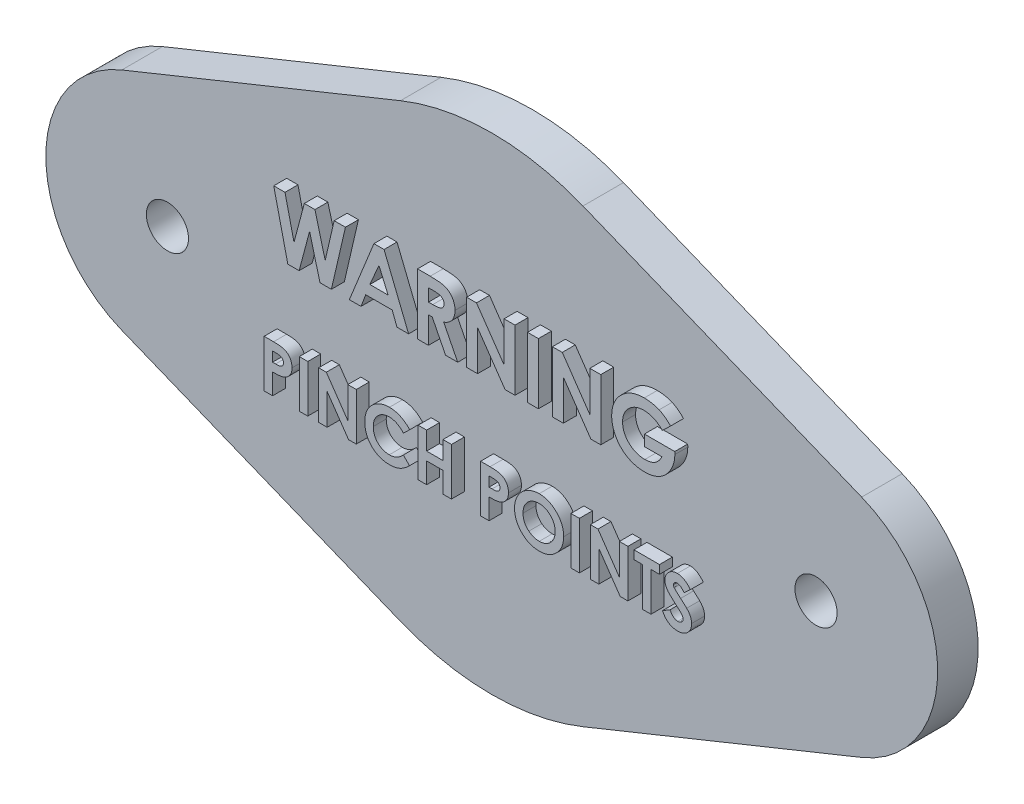
from build123d import *

# Parameters (mm, degrees)
SKETCH1_R              = 38.1
SKETCH1_R_2            = 19.05
BOSS_EXTRUDE1_DEPTH    = 6.35
SKETCH2_R              = 3.302
CUT_EXTRUDE1_DEPTH     = 80.818262321
BOSS_EXTRUDE2_DEPTH    = 2.032
BOSS_EXTRUDE2_2_DEPTH  = 2.032
BOSS_EXTRUDE2_3_DEPTH  = 2.032
BOSS_EXTRUDE2_4_DEPTH  = 2.032
SKETCH3_W              = 1.709615385
SKETCH3_H              = 9.525
BOSS_EXTRUDE2_5_DEPTH  = 2.032
BOSS_EXTRUDE2_6_DEPTH  = 2.032
BOSS_EXTRUDE2_7_DEPTH  = 2.032
BOSS_EXTRUDE2_8_DEPTH  = 2.032
SKETCH3_W_2            = 1.329700855
SKETCH3_H_2            = 7.408333333
BOSS_EXTRUDE2_9_DEPTH  = 2.032
BOSS_EXTRUDE2_10_DEPTH = 2.032
BOSS_EXTRUDE2_11_DEPTH = 2.032
BOSS_EXTRUDE2_12_DEPTH = 2.032
BOSS_EXTRUDE2_13_DEPTH = 2.032
BOSS_EXTRUDE2_14_DEPTH = 2.032
SKETCH3_W_3            = 1.329700854
BOSS_EXTRUDE2_15_DEPTH = 2.032
BOSS_EXTRUDE2_16_DEPTH = 2.032
BOSS_EXTRUDE2_17_DEPTH = 2.032
BOSS_EXTRUDE2_18_DEPTH = 2.032


with BuildPart() as part:
    # Sketch1 → Boss-Extrude1 (new body)
    with BuildSketch(Plane.XY):
        Circle(SKETCH1_R)
        with Locations((-50.8, 0)):
            Circle(SKETCH1_R_2)
        with BuildLine():
            Line((-14.2875, 35.319645295), (-57.94375, 17.659822647))
            ThreePointArc((-57.94375, 17.659822647), (-46.126174273, 18.467751706), (-36.115625, 12.135552351))
            ThreePointArc((-36.115625, 12.135552351), (-27.739760162, 26.117344929), (-14.2875, 35.319645295))
        make_face()
        with Locations((50.8, 0)):
            Circle(SKETCH1_R_2)
        with BuildLine():
            ThreePointArc((-36.115625, -12.135552351), (-46.126174273, -18.467751706), (-57.94375, -17.659822647))
            Line((-57.94375, -17.659822647), (-14.2875, -35.319645295))
            ThreePointArc((-14.2875, -35.319645295), (-27.739760162, -26.117344929), (-36.115625, -12.135552351))
        make_face()
        with BuildLine():
            ThreePointArc((36.115625, -12.135552351), (27.739760162, -26.117344929), (14.2875, -35.319645295))
            Line((14.2875, -35.319645295), (57.94375, -17.659822647))
            ThreePointArc((57.94375, -17.659822647), (46.126174273, -18.467751706), (36.115625, -12.135552351))
        make_face()
        with BuildLine():
            Line((57.94375, 17.659822647), (14.2875, 35.319645295))
            ThreePointArc((14.2875, 35.319645295), (27.739760162, 26.117344929), (36.115625, 12.135552351))
            ThreePointArc((36.115625, 12.135552351), (46.126174273, 18.467751706), (57.94375, 17.659822647))
        make_face()
    extrude(amount=BOSS_EXTRUDE1_DEPTH)

    # Sketch2 → Cut-Extrude1 (cut, through all)
    with BuildSketch(Plane.XY.offset(6.35)):
        with Locations((-50.8, 0)):
            Circle(SKETCH2_R)
        with Locations((50.8, 0)):
            Circle(SKETCH2_R)
    extrude(amount=-CUT_EXTRUDE1_DEPTH, mode=Mode.SUBTRACT)


with BuildPart() as body_2:
    # Sketch3 → Boss-Extrude2 (new body)
    with BuildSketch(Plane.XY.offset(6.35)):
        Polygon((-32.116346154, 15.875), (-30.351397236, 15.875), (-28.941346154, 9.794035457), (-27.325225361, 15.875), (-25.663311298, 15.875), (-24.056730769, 9.794035457), (-22.650495793, 15.875), (-20.881730769, 15.875), (-23.085531851, 6.35), (-24.871469351, 6.35), (-26.499038462, 12.507286659), (-28.136147837, 6.35), (-29.908728966, 6.35), align=None)
    extrude(amount=BOSS_EXTRUDE2_DEPTH)


with BuildPart() as body_3:
    # Sketch3 → Boss-Extrude2 2 (new body)
    with BuildSketch(Plane.XY.offset(6.35)):
        Polygon((-16.422611178, 15.875), (-14.837019231, 15.875), (-10.990384615, 6.35), (-12.816391226, 6.35), (-13.556715745, 8.303846154), (-17.706730769, 8.303846154), (-18.447055288, 6.35), (-20.271153846, 6.35), align=None)
        Polygon((-15.630769231, 13.320117187), (-17.057992788, 10.013461538), (-14.203545673, 10.013461538), align=None, mode=Mode.SUBTRACT)
    extrude(amount=BOSS_EXTRUDE2_2_DEPTH)


with BuildPart() as body_4:
    # Sketch3 → Boss-Extrude2 3 (new body)
    with BuildSketch(Plane.XY.offset(6.35)):
        with BuildLine():
            Line((-9.586057692, 15.875), (-7.594050481, 15.875))
            add(Edge.make_bspline(
                [(-7.594050481, 15.875), (-7.46237941, 15.874532643), (-7.209138852, 15.873633785), (-6.8439798, 15.859452176), (-6.508530992, 15.839717304), (-6.202295767, 15.809601365), (-5.925405138, 15.769671271), (-5.677581595, 15.722600298), (-5.458832382, 15.668952831), (-5.267312651, 15.602103856), (-5.094475565, 15.526699225), (-4.933367371, 15.440057921), (-4.780433784, 15.343144724), (-4.636697, 15.233409583), (-4.500907911, 15.112826607), (-4.372810345, 14.981274418), (-4.254214437, 14.837637507), (-4.145854539, 14.682823478), (-4.047093215, 14.519962669), (-3.959808918, 14.348831472), (-3.888829182, 14.169310876), (-3.826110977, 13.983995342), (-3.780937086, 13.790235748), (-3.749519305, 13.589918376), (-3.726516435, 13.382338089), (-3.72519388, 13.241317258), (-3.724519231, 13.16938101)],
                knots=[0, 0, 0, 0, 1.749336639, 3.364467119, 4.854658419, 6.213483162, 7.451590619, 8.570285859, 9.5643256, 10.440900261, 11.26203566, 12.067320669, 12.869050712, 13.665104639, 14.467235401, 15.27997916, 16.102287765, 16.939272006, 17.78853747, 18.631303466, 19.488103222, 20.351255419, 21.228522269, 22.127379805, 23.044756219, 24, 24, 24, 24], degree=3))
            add(Edge.make_bspline(
                [(-3.724519231, 13.16938101), (-3.726271728, 13.094296092), (-3.729708055, 12.947068252), (-3.748217984, 12.730802564), (-3.782048318, 12.523894681), (-3.833289282, 12.326950403), (-3.892184114, 12.13751853), (-3.970499134, 11.959094198), (-4.058885374, 11.789082484), (-4.163859128, 11.629888267), (-4.279062696, 11.477975527), (-4.413042021, 11.339164603), (-4.557117302, 11.205994935), (-4.719387536, 11.086807818), (-4.892699698, 10.973544251), (-5.080497321, 10.870897296), (-5.281554772, 10.776286644), (-5.422908116, 10.72352521), (-5.495192308, 10.696544471)],
                knots=[0, 0, 0, 0, 1.099860209, 2.156625411, 3.176576793, 4.16617041, 5.135385252, 6.078461593, 7.016046972, 7.938469504, 8.868247731, 9.803980173, 10.76021508, 11.73834243, 12.748633912, 13.790971185, 14.870363756, 16, 16, 16, 16], degree=3))
            Line((-5.495192308, 10.696544471), (-3.297115385, 6.35))
            Line((-3.297115385, 6.35), (-5.197536058, 6.35))
            Line((-5.197536058, 6.35), (-7.296394231, 10.501923077))
            Line((-7.296394231, 10.501923077), (-7.876442308, 10.501923077))
            Line((-7.876442308, 10.501923077), (-7.876442308, 6.35))
            Line((-7.876442308, 6.35), (-9.586057692, 6.35))
            Line((-9.586057692, 6.35), (-9.586057692, 15.875))
        make_face()
        with BuildLine():
            Line((-7.876442308, 12.211538462), (-7.210531851, 12.211538462))
            add(Edge.make_bspline(
                [(-7.210531851, 12.211538462), (-7.129118762, 12.21245539), (-6.973230191, 12.214211112), (-6.749041951, 12.222354878), (-6.545425562, 12.241977329), (-6.361506629, 12.266769563), (-6.196359686, 12.295395778), (-6.051457787, 12.336418881), (-5.924568215, 12.380376175), (-5.817194616, 12.435003688), (-5.72545708, 12.497127019), (-5.646247589, 12.567700667), (-5.580729983, 12.649380679), (-5.526805651, 12.739947343), (-5.484858383, 12.840201701), (-5.454240092, 12.949043185), (-5.437128995, 13.067711641), (-5.435160305, 13.149609034), (-5.434134615, 13.192277644)],
                knots=[0, 0, 0, 0, 1.688639943, 3.233382647, 4.650958383, 5.928841754, 7.082724185, 8.122798841, 9.049171256, 9.863274652, 10.613301712, 11.341792392, 12.054588806, 12.776240173, 13.521029143, 14.301969904, 15.115324896, 16, 16, 16, 16], degree=3))
            add(Edge.make_bspline(
                [(-5.434134615, 13.192277644), (-5.436073775, 13.242757725), (-5.439882894, 13.34191649), (-5.477681189, 13.484670342), (-5.537847911, 13.616798799), (-5.620320007, 13.737704871), (-5.72418289, 13.843699481), (-5.843373743, 13.937134574), (-5.980464992, 14.011016054), (-6.107401173, 14.059747491), (-6.222883427, 14.088904013), (-6.327102517, 14.110631195), (-6.447788852, 14.126029873), (-6.585033541, 14.142362912), (-6.738486745, 14.15295406), (-6.908984875, 14.160683488), (-7.096038261, 14.163845977), (-7.226432237, 14.164856968), (-7.294486178, 14.165384615)],
                knots=[0, 0, 0, 0, 1.020303359, 2.004196876, 2.966617323, 3.9489082, 4.950758222, 5.960522915, 7.003732012, 8.091992268, 8.70421221, 9.413913587, 10.24622431, 11.166358409, 12.212345909, 13.359657661, 14.621978493, 16, 16, 16, 16], degree=3))
            Line((-7.294486178, 14.165384615), (-7.876442308, 14.165384615))
            Line((-7.876442308, 14.165384615), (-7.876442308, 12.211538462))
        make_face(mode=Mode.SUBTRACT)
    extrude(amount=BOSS_EXTRUDE2_3_DEPTH)


with BuildPart() as body_5:
    # Sketch3 → Boss-Extrude2 4 (new body)
    with BuildSketch(Plane.XY.offset(6.35)):
        Polygon((-1.892788462, 15.875), (-0.352989784, 15.875), (3.96875, 9.607046274), (3.96875, 15.875), (5.678365385, 15.875), (5.678365385, 6.35), (4.127118389, 6.35), (-0.183173077, 12.598873197), (-0.183173077, 6.35), (-1.892788462, 6.35), align=None)
    extrude(amount=BOSS_EXTRUDE2_4_DEPTH)


with BuildPart() as body_6:
    # Sketch3 → Boss-Extrude2 5 (new body)
    with BuildSketch(Plane.XY.offset(6.35)):
        with Locations((8.487019231, 11.1125)):
            Rectangle(SKETCH3_W, SKETCH3_H)
    extrude(amount=BOSS_EXTRUDE2_5_DEPTH)


with BuildPart() as body_7:
    # Sketch3 → Boss-Extrude2 6 (new body)
    with BuildSketch(Plane.XY.offset(6.35)):
        Polygon((11.539903846, 15.875), (13.079702524, 15.875), (17.401442308, 9.607046274), (17.401442308, 15.875), (19.111057692, 15.875), (19.111057692, 6.35), (17.559810697, 6.35), (13.249519231, 12.598873197), (13.249519231, 6.35), (11.539903846, 6.35), align=None)
    extrude(amount=BOSS_EXTRUDE2_6_DEPTH)


with BuildPart() as body_8:
    # Sketch3 → Boss-Extrude2 7 (new body)
    with BuildSketch(Plane.XY.offset(6.35)):
        with BuildLine():
            Line((30.038476563, 14.36000601), (28.744816707, 13.121679687))
            add(Edge.make_bspline(
                [(28.744816707, 13.121679687), (28.642395399, 13.224223714), (28.441427883, 13.425432025), (28.112770651, 13.687318468), (27.772381503, 13.909973718), (27.419140083, 14.093056439), (27.052554322, 14.235071314), (26.673347651, 14.336659099), (26.28090315, 14.396912535), (26.01523574, 14.405347811), (25.880829327, 14.409615385)],
                knots=[0, 0, 0, 0, 1.075575784, 2.110457258, 3.113929901, 4.09197124, 5.059417775, 6.02750972, 7.002078037, 8, 8, 8, 8], degree=3))
            add(Edge.make_bspline(
                [(25.880829327, 14.409615385), (25.764303076, 14.406625115), (25.535493568, 14.400753459), (25.199280033, 14.356164505), (24.878007406, 14.281680662), (24.570157861, 14.178495735), (24.277610927, 14.044219532), (23.998671532, 13.880924449), (23.735056273, 13.687361265), (23.488840928, 13.467199265), (23.264661065, 13.226826813), (23.068940206, 12.969543291), (22.902228082, 12.700144248), (22.764990004, 12.417251396), (22.660566751, 12.121298922), (22.586022212, 11.812501671), (22.538704967, 11.491757051), (22.533118214, 11.27294175), (22.530288462, 11.162109375)],
                knots=[0, 0, 0, 0, 1.075001177, 2.110859044, 3.123021556, 4.114053297, 5.101481495, 6.087880186, 7.091499647, 8.114004866, 9.131394192, 10.11971144, 11.092043119, 12.050101265, 13.015322563, 13.981809771, 14.977764287, 16, 16, 16, 16], degree=3))
            add(Edge.make_bspline(
                [(22.530288462, 11.162109375), (22.532927919, 11.047440943), (22.538128012, 10.821528434), (22.588080783, 10.489992116), (22.665041628, 10.171030287), (22.777691784, 9.86700957), (22.91633001, 9.573765307), (23.092146122, 9.296977917), (23.297165303, 9.032420553), (23.531021212, 8.784699312), (23.78539605, 8.556359945), (24.060892274, 8.35938853), (24.349127603, 8.189444716), (24.654754167, 8.054854709), (24.972467193, 7.946793677), (25.305489204, 7.870601376), (25.653070315, 7.823857664), (25.890221773, 7.81823708), (26.010576923, 7.815384615)],
                knots=[0, 0, 0, 0, 1.022067601, 2.013613092, 2.983553406, 3.943623673, 4.90013463, 5.87121881, 6.861774014, 7.881098904, 8.905697761, 9.905387765, 10.89678721, 11.884561068, 12.87834324, 13.885584958, 14.926927371, 16, 16, 16, 16], degree=3))
            add(Edge.make_bspline(
                [(26.010576923, 7.815384615), (26.088863491, 7.816090982), (26.242557443, 7.817477735), (26.468000279, 7.839988652), (26.683920367, 7.872170624), (26.891153906, 7.914775733), (27.087608393, 7.975069608), (27.276003874, 8.04557587), (27.455236519, 8.128787317), (27.624334547, 8.2275749), (27.785814626, 8.338303705), (27.938165272, 8.465001005), (28.084058895, 8.604810242), (28.221790746, 8.759439382), (28.349029673, 8.930270995), (28.469852089, 9.11416582), (28.582874598, 9.312948902), (28.649656617, 9.453319446), (28.683759014, 9.525)],
                knots=[0, 0, 0, 0, 1.109579412, 2.178351274, 3.208885622, 4.204702371, 5.174744997, 6.119429583, 7.05542196, 7.97267548, 8.893247984, 9.828544973, 10.778894627, 11.756245826, 12.760884819, 13.796418446, 14.874735809, 16, 16, 16, 16], degree=3))
            Line((28.683759014, 9.525), (25.949519231, 9.525))
            Line((25.949519231, 9.525), (25.949519231, 11.234615385))
            Line((25.949519231, 11.234615385), (30.698662861, 11.234615385))
            Line((30.698662861, 11.234615385), (30.712019231, 10.82820012))
            add(Edge.make_bspline(
                [(30.712019231, 10.82820012), (30.710303037, 10.723822368), (30.706873711, 10.515253136), (30.675533271, 10.20472908), (30.62361831, 9.898323482), (30.552645589, 9.596344087), (30.463698816, 9.297309579), (30.350263838, 9.004083462), (30.21743217, 8.714677174), (30.068603711, 8.430320468), (29.901363345, 8.157472477), (29.721304534, 7.899121447), (29.530994139, 7.655714529), (29.326292988, 7.43064299), (29.110388616, 7.222016131), (28.882856011, 7.030636564), (28.642890402, 6.856342358), (28.391762984, 6.697661125), (28.128043343, 6.558586387), (27.85318141, 6.437609816), (27.567592189, 6.334866967), (27.270538354, 6.250640182), (26.962604435, 6.185652517), (26.643783835, 6.14109039), (26.313901453, 6.110809923), (26.090149211, 6.107469775), (25.976231971, 6.105769231)],
                knots=[0, 0, 0, 0, 1.006889344, 2.011981806, 3.007738725, 4.003571281, 5.003404394, 6.015442001, 7.03424805, 8.074616296, 9.110249922, 10.119753985, 11.111721717, 12.089233633, 13.052717867, 14.006597561, 14.955430184, 15.912305663, 16.870361111, 17.829300583, 18.807640451, 19.796414044, 20.806216501, 21.841577364, 22.90109906, 24, 24, 24, 24], degree=3))
            add(Edge.make_bspline(
                [(25.976231971, 6.105769231), (25.85469, 6.107448549), (25.613757561, 6.11077746), (25.25750666, 6.141954972), (24.911590819, 6.193411444), (24.575923759, 6.264625443), (24.249726129, 6.353256953), (23.933558386, 6.464510464), (23.628067179, 6.596850032), (23.332337705, 6.746771257), (23.050149708, 6.916794985), (22.782135618, 7.10393983), (22.529758306, 7.309409609), (22.290432646, 7.529764714), (22.069750211, 7.770421494), (21.859487028, 8.023579096), (21.66982963, 8.298522329), (21.492623311, 8.586337455), (21.335191801, 8.886903863), (21.197515682, 9.194662423), (21.080105566, 9.507831211), (20.987524852, 9.827868445), (20.912357982, 10.152542559), (20.858574676, 10.483265485), (20.828200731, 10.819995823), (20.823193434, 11.046296053), (20.820673077, 11.160201322)],
                knots=[0, 0, 0, 0, 1.084149091, 2.14910686, 3.187506334, 4.202448172, 5.208724393, 6.201130722, 7.189831603, 8.176984443, 9.156919086, 10.126598231, 11.090766514, 12.05840148, 13.026036446, 14.001772938, 14.991905635, 16.003017641, 17.015720547, 18.016462227, 19.009322657, 19.99686681, 20.986544154, 21.980959929, 22.983742515, 24, 24, 24, 24], degree=3))
            add(Edge.make_bspline(
                [(20.820673077, 11.160201322), (20.824048374, 11.31559245), (20.830713584, 11.622443858), (20.892443544, 12.074437928), (20.988671356, 12.511697091), (21.126767954, 12.932628879), (21.3039785, 13.33781313), (21.517792646, 13.728201034), (21.772854899, 14.103377642), (21.970290601, 14.335664069), (22.070447716, 14.453500601)],
                knots=[0, 0, 0, 0, 1.034044851, 2.041932006, 3.031217818, 4.011390712, 4.986069675, 5.97149666, 6.970960976, 8, 8, 8, 8], degree=3))
            add(Edge.make_bspline(
                [(22.070447716, 14.453500601), (22.13263429, 14.521672606), (22.256073705, 14.656993011), (22.453391384, 14.845023467), (22.655713095, 15.021779053), (22.865841025, 15.183511775), (23.082670572, 15.333762043), (23.306825807, 15.469713294), (23.537130866, 15.595694288), (23.775381849, 15.705271959), (24.020331478, 15.803517482), (24.273064597, 15.886647008), (24.531688288, 15.96028001), (24.798492671, 16.016295838), (25.070782385, 16.062941546), (25.350490234, 16.094205942), (25.636853998, 16.117120518), (25.830536045, 16.118521788), (25.928530649, 16.119230769)],
                knots=[0, 0, 0, 0, 1.020590567, 2.025856924, 3.013483481, 3.991664875, 4.957826714, 5.930500614, 6.890802512, 7.860442893, 8.829981142, 9.809047939, 10.802672283, 11.803273349, 12.823572789, 13.857849586, 14.916166035, 16, 16, 16, 16], degree=3))
            add(Edge.make_bspline(
                [(25.928530649, 16.119230769), (26.030966826, 16.117651027), (26.234777203, 16.114507921), (26.537809483, 16.092759674), (26.836630926, 16.059207257), (27.12998227, 16.008876714), (27.418848003, 15.946808679), (27.701732887, 15.867284164), (27.980482395, 15.77692999), (28.161947269, 15.704892968), (28.252539063, 15.668930288)],
                knots=[0, 0, 0, 0, 1.03180557, 2.052914215, 3.058998889, 4.059601663, 5.049854447, 6.033765722, 7.018406786, 8, 8, 8, 8], degree=3))
            add(Edge.make_bspline(
                [(28.252539063, 15.668930288), (28.32876085, 15.6356943), (28.483793858, 15.568093218), (28.709347776, 15.444413868), (28.935452784, 15.307301115), (29.159669095, 15.151741796), (29.381655064, 14.978026881), (29.603728462, 14.788900166), (29.823622285, 14.582156326), (29.965930965, 14.435015117), (30.038476563, 14.36000601)],
                knots=[0, 0, 0, 0, 0.894392155, 1.819168899, 2.76525314, 3.739198753, 4.75366411, 5.797420238, 6.877176959, 8, 8, 8, 8], degree=3))
        make_face()
    extrude(amount=BOSS_EXTRUDE2_7_DEPTH)


with BuildPart() as body_9:
    # Sketch3 → Boss-Extrude2 8 (new body)
    with BuildSketch(Plane.XY.offset(6.35)):
        with BuildLine():
            Line((-33.622435897, -5.291666667), (-32.138394765, -5.291666667))
            add(Edge.make_bspline(
                [(-32.138394765, -5.291666667), (-32.041429443, -5.292100704), (-31.854363011, -5.292938053), (-31.584597825, -5.303092026), (-31.335726233, -5.321288563), (-31.107805412, -5.343776605), (-30.900929078, -5.375303965), (-30.714838159, -5.411447615), (-30.549494038, -5.455481101), (-30.403032212, -5.507748237), (-30.271587455, -5.569369149), (-30.14719832, -5.634999819), (-30.032676015, -5.713327709), (-29.922240254, -5.795910971), (-29.822204839, -5.890638753), (-29.726328962, -5.991206783), (-29.638673229, -6.101603508), (-29.558831475, -6.220492604), (-29.486402702, -6.345677508), (-29.42312408, -6.477382016), (-29.371796005, -6.615814535), (-29.328738133, -6.760079564), (-29.294153631, -6.910170815), (-29.271133085, -7.067011364), (-29.255496372, -7.229506091), (-29.254116648, -7.340100104), (-29.253418803, -7.396036993)],
                knots=[0, 0, 0, 0, 1.698747864, 3.27724071, 4.728299578, 6.070144658, 7.288476769, 8.393259625, 9.389771311, 10.283485332, 11.113357557, 11.931608583, 12.74405601, 13.541433047, 14.344816069, 15.154114104, 15.974336324, 16.810834471, 17.661136416, 18.50621059, 19.367396281, 20.244825668, 21.142564693, 22.063065223, 23.020325768, 24, 24, 24, 24], degree=3))
            add(Edge.make_bspline(
                [(-29.253418803, -7.396036993), (-29.254428498, -7.457918641), (-29.256412671, -7.579523683), (-29.275863962, -7.757781757), (-29.309092912, -7.927734691), (-29.352521413, -8.090815728), (-29.413079368, -8.244341825), (-29.482263989, -8.391976161), (-29.567383016, -8.529579523), (-29.664645113, -8.658873162), (-29.770866418, -8.780908297), (-29.888568622, -8.892161395), (-30.01550827, -8.993390864), (-30.150950553, -9.085657596), (-30.295403962, -9.168775469), (-30.448764268, -9.243522794), (-30.6120787, -9.307508919), (-30.725805958, -9.340973145), (-30.783465211, -9.35793937)],
                knots=[0, 0, 0, 0, 1.102006807, 2.165578795, 3.188629044, 4.184801286, 5.166646146, 6.124351954, 7.085497154, 8.042432466, 9.003981491, 9.963833307, 10.922997304, 11.89326795, 12.880200226, 13.889073926, 14.929769137, 16, 16, 16, 16], degree=3))
            add(Edge.make_bspline(
                [(-30.783465211, -9.35793937), (-30.821442912, -9.367388283), (-30.903714842, -9.387857672), (-31.039852288, -9.40863924), (-31.196736402, -9.427746614), (-31.374874491, -9.444167089), (-31.574369257, -9.455329185), (-31.795027536, -9.464046286), (-32.036949328, -9.470384519), (-32.205172175, -9.470609427), (-32.292735043, -9.470726496)],
                knots=[0, 0, 0, 0, 0.618981996, 1.340914327, 2.176866532, 3.120127938, 4.170906482, 5.338178032, 6.614476169, 8, 8, 8, 8], degree=3))
            Line((-32.292735043, -9.470726496), (-32.292735043, -12.7))
            Line((-32.292735043, -12.7), (-33.622435897, -12.7))
            Line((-33.622435897, -12.7), (-33.622435897, -5.291666667))
        make_face()
        with BuildLine():
            Line((-32.292735043, -8.141025641), (-31.822294004, -8.141025641))
            add(Edge.make_bspline(
                [(-31.822294004, -8.141025641), (-31.736689829, -8.140482844), (-31.579176877, -8.13948409), (-31.364069807, -8.125041521), (-31.191205628, -8.102984801), (-31.054639716, -8.071350364), (-30.946807994, -8.023340917), (-30.853809885, -7.967803027), (-30.774043032, -7.89757689), (-30.704976678, -7.817331512), (-30.64976021, -7.725125551), (-30.611470465, -7.622460402), (-30.586598199, -7.51149317), (-30.584301014, -7.434267321), (-30.583119658, -7.394552951)],
                knots=[0, 0, 0, 0, 1.8619151, 3.425951444, 4.686033666, 5.651700536, 6.461346321, 7.243864085, 7.999046032, 8.762387399, 9.539336099, 10.322741239, 11.137448474, 12, 12, 12, 12], degree=3))
            add(Edge.make_bspline(
                [(-30.583119658, -7.394552951), (-30.584288863, -7.359855024), (-30.5865574, -7.292532702), (-30.603222696, -7.195369894), (-30.629782383, -7.104794113), (-30.668266349, -7.021751303), (-30.718017005, -6.946382567), (-30.778673122, -6.878717596), (-30.849456363, -6.817307287), (-30.904105164, -6.784801872), (-30.931869324, -6.768287593)],
                knots=[0, 0, 0, 0, 1.102301479, 2.1387299, 3.123554645, 4.094223062, 5.036071848, 5.982632524, 6.975082478, 8, 8, 8, 8], degree=3))
            add(Edge.make_bspline(
                [(-30.931869324, -6.768287593), (-30.95538717, -6.756393944), (-31.00517927, -6.731212652), (-31.089980044, -6.701937558), (-31.187838841, -6.677240791), (-31.29941632, -6.656742713), (-31.424267365, -6.640834076), (-31.562369702, -6.628667948), (-31.71392656, -6.623775475), (-31.819325287, -6.622192311), (-31.874235443, -6.621367521)],
                knots=[0, 0, 0, 0, 0.656809284, 1.390599849, 2.23162475, 3.173112763, 4.218524733, 5.370385145, 6.63003504, 8, 8, 8, 8], degree=3))
            Line((-31.874235443, -6.621367521), (-32.292735043, -6.621367521))
            Line((-32.292735043, -6.621367521), (-32.292735043, -8.141025641))
        make_face(mode=Mode.SUBTRACT)
    extrude(amount=BOSS_EXTRUDE2_8_DEPTH)


with BuildPart() as body_10:
    # Sketch3 → Boss-Extrude2 9 (new body)
    with BuildSketch(Plane.XY.offset(6.35)):
        with Locations((-27.448824787, -8.995833334)):
            Rectangle(SKETCH3_W_2, SKETCH3_H_2)
    extrude(amount=BOSS_EXTRUDE2_9_DEPTH)


with BuildPart() as body_11:
    # Sketch3 → Boss-Extrude2 10 (new body)
    with BuildSketch(Plane.XY.offset(6.35)):
        Polygon((-25.074358974, -5.291666667), (-23.87673778, -5.291666667), (-20.515384615, -10.166741787), (-20.515384615, -5.291666667), (-19.185683761, -5.291666667), (-19.185683761, -12.7), (-20.392209201, -12.7), (-23.74465812, -7.839765291), (-23.74465812, -12.7), (-25.074358974, -12.7), align=None)
    extrude(amount=BOSS_EXTRUDE2_10_DEPTH)


with BuildPart() as body_12:
    # Sketch3 → Boss-Extrude2 11 (new body)
    with BuildSketch(Plane.XY.offset(6.35)):
        with BuildLine():
            Line((-10.827564103, -6.576846287), (-11.802579127, -7.508824119))
            add(Edge.make_bspline(
                [(-11.802579127, -7.508824119), (-11.885287844, -7.423303166), (-12.046843881, -7.256253953), (-12.307171455, -7.035095516), (-12.577902653, -6.850789882), (-12.853770941, -6.695568852), (-13.139738388, -6.578133079), (-13.432498433, -6.492555654), (-13.733920435, -6.440382332), (-13.937911252, -6.43441278), (-14.040513154, -6.431410256)],
                knots=[0, 0, 0, 0, 1.115251505, 2.178435587, 3.19620269, 4.182487026, 5.141301733, 6.088180966, 7.038406374, 8, 8, 8, 8], degree=3))
            add(Edge.make_bspline(
                [(-14.040513154, -6.431410256), (-14.126198211, -6.433782355), (-14.29528823, -6.438463431), (-14.543556689, -6.472780334), (-14.7810383, -6.531137722), (-15.008546001, -6.611565011), (-15.22541034, -6.715633656), (-15.432086002, -6.843263108), (-15.628063436, -6.993300693), (-15.810753892, -7.164970109), (-15.977872702, -7.352531846), (-16.125532811, -7.552659772), (-16.249221838, -7.764895406), (-16.350731411, -7.98708938), (-16.429803444, -8.220270118), (-16.48627081, -8.464280634), (-16.518930026, -8.719411526), (-16.523804633, -8.892847605), (-16.526282051, -8.980992922)],
                knots=[0, 0, 0, 0, 1.035432265, 2.043311493, 3.022114605, 3.98653278, 4.95457646, 5.923598177, 6.917315552, 7.932509744, 8.948865224, 9.949768934, 10.933144597, 11.912367597, 12.897413939, 13.903909035, 14.934704909, 16, 16, 16, 16], degree=3))
            add(Edge.make_bspline(
                [(-16.526282051, -8.980992922), (-16.525568088, -9.042859473), (-16.52416085, -9.164799716), (-16.50875615, -9.34518318), (-16.483950949, -9.520197784), (-16.448051679, -9.689578428), (-16.403159288, -9.853471899), (-16.350490291, -10.013292098), (-16.28441781, -10.16683067), (-16.211076359, -10.315870865), (-16.125781097, -10.456345934), (-16.033817069, -10.590300572), (-15.934097095, -10.717078144), (-15.825975284, -10.836160382), (-15.707929955, -10.945686295), (-15.583012143, -11.04894946), (-15.449114658, -11.143364848), (-15.309018889, -11.231301918), (-15.161514587, -11.307693599), (-15.010603884, -11.376889704), (-14.853998672, -11.433087228), (-14.693605711, -11.47838756), (-14.52999819, -11.516908727), (-14.361575876, -11.540627393), (-14.189798779, -11.558589262), (-14.073706294, -11.559698302), (-14.015284455, -11.56025641)],
                knots=[0, 0, 0, 0, 1.103660481, 2.175337485, 3.227646561, 4.255952547, 5.262355991, 6.258840057, 7.255597736, 8.242457506, 9.22035537, 10.185017736, 11.140346927, 12.096287581, 13.051739095, 14.01125915, 14.986044842, 15.97314143, 16.960198552, 17.947847494, 18.933482797, 19.925264591, 20.920966487, 21.929612487, 22.958107872, 24, 24, 24, 24], degree=3))
            add(Edge.make_bspline(
                [(-14.015284455, -11.56025641), (-13.916190976, -11.557390101), (-13.721498058, -11.551758549), (-13.435758205, -11.507720606), (-13.163476593, -11.435280684), (-12.945924888, -11.349733344), (-12.775478873, -11.265254235), (-12.645720842, -11.18711522), (-12.511540924, -11.099708153), (-12.375167734, -10.999734195), (-12.235067343, -10.888393075), (-12.093712846, -10.763246215), (-11.947485544, -10.62841452), (-11.851693487, -10.532182491), (-11.802579127, -10.482842548)],
                knots=[0, 0, 0, 0, 1.404581149, 2.759636711, 4.088442092, 5.392261763, 6.066678138, 6.783632037, 7.538459478, 8.336747902, 9.180226004, 10.074962426, 11.012997595, 12, 12, 12, 12], degree=3))
            Line((-11.802579127, -10.482842548), (-10.857244925, -11.475666066))
            add(Edge.make_bspline(
                [(-10.857244925, -11.475666066), (-10.923696831, -11.539823295), (-11.053396741, -11.665044485), (-11.249045453, -11.842846891), (-11.444447934, -12.002622118), (-11.634883667, -12.150169307), (-11.823472187, -12.28119005), (-12.010193495, -12.395815199), (-12.192933823, -12.496943789), (-12.375487835, -12.582870337), (-12.558991474, -12.6558309), (-12.747795154, -12.718645156), (-12.942476066, -12.771783757), (-13.144223232, -12.81465963), (-13.351154876, -12.849040291), (-13.565207605, -12.872247038), (-13.785024218, -12.887848163), (-13.934129233, -12.889250053), (-14.009348291, -12.889957265)],
                knots=[0, 0, 0, 0, 1.244526981, 2.429050516, 3.560637417, 4.644440555, 5.67424972, 6.652764056, 7.595344123, 8.486817594, 9.369275933, 10.254498637, 11.166417451, 12.086725134, 13.032340136, 13.991389299, 14.986715468, 16, 16, 16, 16], degree=3))
            add(Edge.make_bspline(
                [(-14.009348291, -12.889957265), (-14.147516383, -12.886435085), (-14.417872933, -12.879543157), (-14.814073407, -12.82847864), (-15.190453223, -12.742869876), (-15.547928041, -12.621795471), (-15.886384193, -12.467128593), (-16.205735092, -12.277514263), (-16.505466014, -12.053456256), (-16.783155724, -11.797580751), (-17.034339283, -11.514987735), (-17.25635646, -11.211560363), (-17.440009078, -10.885807401), (-17.592499803, -10.542541259), (-17.711745545, -10.180195481), (-17.795674332, -9.798378121), (-17.847432602, -9.397457844), (-17.853095031, -9.123620054), (-17.855982906, -8.983961004)],
                knots=[0, 0, 0, 0, 1.078019885, 2.10938526, 3.111377082, 4.085535484, 5.04941344, 6.010039228, 6.978205633, 7.964457913, 8.951525778, 9.924444315, 10.892603023, 11.863865945, 12.85144698, 13.863884204, 14.910567087, 16, 16, 16, 16], degree=3))
            add(Edge.make_bspline(
                [(-17.855982906, -8.983961004), (-17.85476263, -8.892876564), (-17.852344341, -8.712369464), (-17.8269279, -8.446467882), (-17.791495903, -8.187261403), (-17.735286263, -7.937441447), (-17.667531085, -7.69364248), (-17.583268619, -7.458514312), (-17.482633444, -7.231381161), (-17.368869269, -7.011862792), (-17.240168996, -6.801397286), (-17.096396662, -6.601792872), (-16.941253528, -6.411508643), (-16.771011757, -6.233069071), (-16.588145185, -6.064907422), (-16.391828191, -5.907934996), (-16.183241523, -5.759900632), (-15.961820614, -5.624621777), (-15.731867083, -5.502254862), (-15.49628125, -5.394322017), (-15.25564192, -5.304115013), (-15.01096654, -5.229291631), (-14.761221358, -5.173441268), (-14.508188992, -5.131164344), (-14.249716441, -5.107531273), (-14.076174515, -5.103662389), (-13.988571715, -5.101709402)],
                knots=[0, 0, 0, 0, 1.071919942, 2.124283339, 3.142214191, 4.149696895, 5.136002878, 6.119640489, 7.086990633, 8.058538607, 9.028339693, 9.988281803, 10.952401235, 11.916291999, 12.888973767, 13.874849856, 14.873389453, 15.898127285, 16.927174885, 17.938320013, 18.946391617, 19.950418109, 20.947802303, 21.956882652, 22.968648068, 24, 24, 24, 24], degree=3))
            add(Edge.make_bspline(
                [(-13.988571715, -5.101709402), (-13.913837544, -5.102828903), (-13.76514623, -5.105056265), (-13.543719912, -5.12362375), (-13.324064458, -5.152783799), (-13.106966301, -5.196780102), (-12.890872535, -5.249009274), (-12.678622873, -5.31739617), (-12.466868962, -5.393626253), (-12.258931848, -5.484743752), (-12.054521281, -5.584206733), (-11.8584259, -5.697051097), (-11.667353283, -5.816332528), (-11.485537482, -5.949110623), (-11.309572699, -6.090569274), (-11.140379066, -6.241368466), (-10.979441358, -6.404022463), (-10.878445789, -6.518947114), (-10.827564103, -6.576846287)],
                knots=[0, 0, 0, 0, 0.996412454, 1.982464992, 2.961075852, 3.949442424, 4.934965278, 5.923860011, 6.921385422, 7.934793307, 8.949617135, 9.951082467, 10.950285876, 11.951772932, 12.951063433, 13.960125323, 14.972308753, 16, 16, 16, 16], degree=3))
        make_face()
    extrude(amount=BOSS_EXTRUDE2_11_DEPTH)


with BuildPart() as body_13:
    # Sketch3 → Boss-Extrude2 12 (new body)
    with BuildSketch(Plane.XY.offset(6.35)):
        Polygon((-9.497863248, -5.291666667), (-8.168162393, -5.291666667), (-8.168162393, -8.141025641), (-5.603739316, -8.141025641), (-5.603739316, -5.291666667), (-4.274038462, -5.291666667), (-4.274038462, -12.7), (-5.603739316, -12.7), (-5.603739316, -9.470726496), (-8.168162393, -9.470726496), (-8.168162393, -12.7), (-9.497863248, -12.7), align=None)
    extrude(amount=BOSS_EXTRUDE2_12_DEPTH)


with BuildPart() as body_14:
    # Sketch3 → Boss-Extrude2 13 (new body)
    with BuildSketch(Plane.XY.offset(6.35)):
        with BuildLine():
            Line((0.284935897, -5.291666667), (1.76897703, -5.291666667))
            add(Edge.make_bspline(
                [(1.76897703, -5.291666667), (1.865942352, -5.292100704), (2.053008784, -5.292938053), (2.32277397, -5.303092026), (2.571645562, -5.321288563), (2.799566383, -5.343776605), (3.006442717, -5.375303965), (3.192533636, -5.411447615), (3.357877757, -5.455481101), (3.504339583, -5.507748237), (3.63578434, -5.569369149), (3.760173475, -5.634999819), (3.87469578, -5.713327709), (3.985131541, -5.795910971), (4.085166956, -5.890638753), (4.181042833, -5.991206783), (4.268698566, -6.101603508), (4.34854032, -6.220492604), (4.420969093, -6.345677508), (4.484247715, -6.477382016), (4.53557579, -6.615814535), (4.578633662, -6.760079564), (4.613218164, -6.910170815), (4.63623871, -7.067011364), (4.651875423, -7.229506091), (4.653255147, -7.340100104), (4.653952991, -7.396036993)],
                knots=[0, 0, 0, 0, 1.698747864, 3.27724071, 4.728299578, 6.070144658, 7.288476769, 8.393259625, 9.389771311, 10.283485332, 11.113357557, 11.931608583, 12.74405601, 13.541433047, 14.344816069, 15.154114104, 15.974336324, 16.810834471, 17.661136416, 18.50621059, 19.367396281, 20.244825668, 21.142564693, 22.063065223, 23.020325768, 24, 24, 24, 24], degree=3))
            add(Edge.make_bspline(
                [(4.653952991, -7.396036993), (4.652943297, -7.457918641), (4.650959124, -7.579523683), (4.631507833, -7.757781757), (4.598278882, -7.927734691), (4.554850382, -8.090815728), (4.494292427, -8.244341825), (4.425107806, -8.391976161), (4.339988779, -8.529579523), (4.242726682, -8.658873162), (4.136505376, -8.780908297), (4.018803173, -8.892161395), (3.891863525, -8.993390864), (3.756421242, -9.085657596), (3.611967833, -9.168775469), (3.458607527, -9.243522794), (3.295293094, -9.307508919), (3.181565837, -9.340973145), (3.123906584, -9.35793937)],
                knots=[0, 0, 0, 0, 1.102006807, 2.165578795, 3.188629044, 4.184801286, 5.166646146, 6.124351954, 7.085497154, 8.042432466, 9.003981491, 9.963833307, 10.922997304, 11.89326795, 12.880200226, 13.889073926, 14.929769137, 16, 16, 16, 16], degree=3))
            add(Edge.make_bspline(
                [(3.123906584, -9.35793937), (3.085928883, -9.367388283), (3.003656953, -9.387857672), (2.867519507, -9.40863924), (2.710635393, -9.427746614), (2.532497304, -9.444167089), (2.333002538, -9.455329185), (2.112344259, -9.464046286), (1.870422467, -9.470384519), (1.70219962, -9.470609427), (1.614636752, -9.470726496)],
                knots=[0, 0, 0, 0, 0.618981996, 1.340914327, 2.176866532, 3.120127938, 4.170906482, 5.338178032, 6.614476169, 8, 8, 8, 8], degree=3))
            Line((1.614636752, -9.470726496), (1.614636752, -12.7))
            Line((1.614636752, -12.7), (0.284935897, -12.7))
            Line((0.284935897, -12.7), (0.284935897, -5.291666667))
        make_face()
        with BuildLine():
            Line((1.614636752, -8.141025641), (2.085077791, -8.141025641))
            add(Edge.make_bspline(
                [(2.085077791, -8.141025641), (2.170681965, -8.140482844), (2.328194918, -8.13948409), (2.543301988, -8.125041521), (2.716166167, -8.102984801), (2.852732078, -8.071350364), (2.960563801, -8.023340917), (3.05356191, -7.967803027), (3.133328763, -7.89757689), (3.202395117, -7.817331512), (3.257611585, -7.725125551), (3.29590133, -7.622460402), (3.320773596, -7.51149317), (3.32307078, -7.434267321), (3.324252137, -7.394552951)],
                knots=[0, 0, 0, 0, 1.8619151, 3.425951444, 4.686033666, 5.651700536, 6.461346321, 7.243864085, 7.999046032, 8.762387399, 9.539336099, 10.322741239, 11.137448474, 12, 12, 12, 12], degree=3))
            add(Edge.make_bspline(
                [(3.324252137, -7.394552951), (3.323082932, -7.359855024), (3.320814395, -7.292532702), (3.304149099, -7.195369894), (3.277589411, -7.104794113), (3.239105445, -7.021751303), (3.18935479, -6.946382567), (3.128698673, -6.878717596), (3.057915431, -6.817307287), (3.003266631, -6.784801872), (2.975502471, -6.768287593)],
                knots=[0, 0, 0, 0, 1.102301479, 2.1387299, 3.123554645, 4.094223062, 5.036071848, 5.982632524, 6.975082478, 8, 8, 8, 8], degree=3))
            add(Edge.make_bspline(
                [(2.975502471, -6.768287593), (2.951984624, -6.756393944), (2.902192525, -6.731212652), (2.817391751, -6.701937558), (2.719532954, -6.677240791), (2.607955475, -6.656742713), (2.48310443, -6.640834076), (2.345002093, -6.628667948), (2.193445234, -6.623775475), (2.088046508, -6.622192311), (2.033136351, -6.621367521)],
                knots=[0, 0, 0, 0, 0.656809284, 1.390599849, 2.23162475, 3.173112763, 4.218524733, 5.370385145, 6.63003504, 8, 8, 8, 8], degree=3))
            Line((2.033136351, -6.621367521), (1.614636752, -6.621367521))
            Line((1.614636752, -6.621367521), (1.614636752, -8.141025641))
        make_face(mode=Mode.SUBTRACT)
    extrude(amount=BOSS_EXTRUDE2_13_DEPTH)


with BuildPart() as body_15:
    # Sketch3 → Boss-Extrude2 14 (new body)
    with BuildSketch(Plane.XY.offset(6.35)):
        with BuildLine():
            add(Edge.make_bspline(
                [(9.465214343, -5.101709402), (9.594017297, -5.105044341), (9.848303503, -5.111628266), (10.222266748, -5.166510421), (10.582649481, -5.255933025), (10.929288736, -5.380236913), (11.26131657, -5.542788864), (11.579904156, -5.738980426), (11.883910327, -5.972514595), (12.170219873, -6.237943406), (12.43482153, -6.526585648), (12.664099021, -6.837360338), (12.859618454, -7.162214992), (13.021665483, -7.502020066), (13.145094457, -7.859128874), (13.231709674, -8.231720633), (13.287355659, -8.619689343), (13.293755804, -8.883843154), (13.297008547, -9.01809395)],
                knots=[0, 0, 0, 0, 1.014329547, 2.002516266, 2.970391464, 3.935626869, 4.897733899, 5.877609409, 6.878433252, 7.912639331, 8.949961323, 9.958554974, 10.949718813, 11.932905612, 12.9188844, 13.919928257, 14.942845884, 16, 16, 16, 16], degree=3))
            add(Edge.make_bspline(
                [(13.297008547, -9.01809395), (13.293544516, -9.150832051), (13.286718533, -9.412396736), (13.233981387, -9.796790161), (13.145907559, -10.165390686), (13.024572036, -10.519032645), (12.865463928, -10.856003118), (12.673757337, -11.178453615), (12.444393491, -11.483391718), (12.185738191, -11.770653786), (11.900981152, -12.031405752), (11.599378243, -12.261192972), (11.282322081, -12.455905991), (10.950276733, -12.61545562), (10.602530145, -12.739276211), (10.239941294, -12.826640636), (9.862532616, -12.87973376), (9.605876412, -12.886515157), (9.475602631, -12.889957265)],
                knots=[0, 0, 0, 0, 1.051557043, 2.072126891, 3.067553643, 4.050577992, 5.02905126, 6.015227836, 7.017913613, 8.04756643, 9.074058332, 10.072836633, 11.047628519, 12.017157415, 12.98668631, 13.966869689, 14.968021931, 16, 16, 16, 16], degree=3))
            add(Edge.make_bspline(
                [(9.475602631, -12.889957265), (9.339351876, -12.886869525), (9.071637767, -12.880802538), (8.67983697, -12.82310826), (8.304457952, -12.736200522), (7.948654113, -12.606495387), (7.608801895, -12.444353061), (7.287398292, -12.244665066), (6.984551316, -12.007761401), (6.701998148, -11.739709257), (6.446004294, -11.446401419), (6.220039504, -11.136547699), (6.029433191, -10.812515106), (5.874178381, -10.474151986), (5.751781726, -10.123561183), (5.665444793, -9.758607499), (5.614443506, -9.380166225), (5.607339322, -9.123121347), (5.603739316, -8.992865251)],
                knots=[0, 0, 0, 0, 1.067978421, 2.098431617, 3.099715153, 4.085208694, 5.062210972, 6.048429807, 7.046490867, 8.072918869, 9.098532598, 10.095778865, 11.076610158, 12.041847152, 13.011192615, 13.984257998, 14.978533688, 16, 16, 16, 16], degree=3))
            add(Edge.make_bspline(
                [(5.603739316, -8.992865251), (5.604869206, -8.905235769), (5.607114677, -8.731086394), (5.634163749, -8.47300591), (5.673106636, -8.219962811), (5.730701317, -7.972965982), (5.800664135, -7.730272977), (5.891310848, -7.494142842), (5.994491338, -7.262053058), (6.115048027, -7.036744895), (6.249095408, -6.820291377), (6.395353035, -6.613713554), (6.554188671, -6.419509252), (6.725090654, -6.236402241), (6.908647935, -6.065596098), (7.102446008, -5.904672822), (7.310243427, -5.757907109), (7.527492158, -5.621714647), (7.752967403, -5.498558166), (7.985751274, -5.393731052), (8.221047963, -5.30218732), (8.462000715, -5.229936958), (8.706027295, -5.171089794), (8.955734631, -5.132173155), (9.208866759, -5.105124832), (9.37956236, -5.10285058), (9.465214343, -5.101709402)],
                knots=[0, 0, 0, 0, 1.034744296, 2.056386356, 3.06226378, 4.057406941, 5.050368692, 6.043467995, 7.042652155, 8.049140477, 9.059438543, 10.048523776, 11.036952808, 12.020949711, 13.004946614, 13.997082645, 14.994316842, 16.007702937, 17.024872941, 18.026463647, 19.021641123, 20.005082605, 20.995858141, 21.984425357, 22.988620895, 24, 24, 24, 24], degree=3))
        make_face()
        with BuildLine():
            add(Edge.make_bspline(
                [(9.444437767, -6.431410256), (9.357753396, -6.433736193), (9.186673135, -6.43832666), (8.935729549, -6.473299814), (8.694814844, -6.529155916), (8.465264506, -6.610062797), (8.246083643, -6.713036722), (8.036883717, -6.837717888), (7.840561713, -6.98839207), (7.654499867, -7.156970244), (7.486423606, -7.344805071), (7.337922927, -7.546102034), (7.213651778, -7.760524968), (7.109573912, -7.986081936), (7.031226346, -8.225309267), (6.975421723, -8.476333066), (6.940155285, -8.73958586), (6.935709907, -8.919044948), (6.933440171, -9.010673745)],
                knots=[0, 0, 0, 0, 1.033739768, 2.040188636, 3.016340934, 3.979330865, 4.937572243, 5.900995986, 6.878200029, 7.884839167, 8.891893314, 9.879764717, 10.863503415, 11.843163062, 12.837761627, 13.859916423, 14.907309254, 16, 16, 16, 16], degree=3))
            add(Edge.make_bspline(
                [(6.933440171, -9.010673745), (6.936449494, -9.112219063), (6.942347268, -9.311231063), (6.983844724, -9.601544406), (7.054842741, -9.875716545), (7.157362496, -10.132406545), (7.284513889, -10.374464756), (7.442415739, -10.598924411), (7.628510784, -10.807129469), (7.771876899, -10.928688254), (7.844641426, -10.990384615)],
                knots=[0, 0, 0, 0, 1.078454662, 2.113592447, 3.107694534, 4.079536787, 5.043276885, 6.005368276, 6.987637804, 8, 8, 8, 8], degree=3))
            add(Edge.make_bspline(
                [(7.844641426, -10.990384615), (7.904249466, -11.035963517), (8.022122566, -11.12609442), (8.210273696, -11.241615663), (8.404032312, -11.340628892), (8.604860564, -11.420630409), (8.812334314, -11.483558258), (9.026425112, -11.527625596), (9.246829608, -11.555281661), (9.395877457, -11.558587085), (9.471150507, -11.56025641)],
                knots=[0, 0, 0, 0, 1.023928204, 2.024787132, 3.009472467, 3.9914905, 4.972207045, 5.96565515, 6.972602802, 8, 8, 8, 8], degree=3))
            add(Edge.make_bspline(
                [(9.471150507, -11.56025641), (9.556344339, -11.557910753), (9.723965881, -11.553295597), (9.970238017, -11.518752982), (10.206174203, -11.460294406), (10.433239152, -11.380097269), (10.650778108, -11.275830417), (10.8577279, -11.147282032), (11.054451368, -10.996030524), (11.240276173, -10.825238549), (11.410128829, -10.636663782), (11.558319618, -10.434293123), (11.686541969, -10.222585402), (11.788455534, -9.998544219), (11.869898436, -9.764284416), (11.92503142, -9.518768507), (11.96059578, -9.263008603), (11.965042411, -9.08895495), (11.967307692, -9.000285457)],
                knots=[0, 0, 0, 0, 1.026359118, 2.019393844, 2.989460624, 3.950973911, 4.916101784, 5.890408035, 6.881132271, 7.902007068, 8.92769091, 9.933912415, 10.920395702, 11.90457117, 12.894218921, 13.903490204, 14.931958862, 16, 16, 16, 16], degree=3))
            add(Edge.make_bspline(
                [(11.967307692, -9.000285457), (11.964964032, -8.912125837), (11.960350894, -8.738597072), (11.925747482, -8.483494725), (11.867659634, -8.239062697), (11.787221674, -8.004901805), (11.684506657, -7.780782485), (11.55748912, -7.567492873), (11.406614749, -7.365239167), (11.23535591, -7.175399649), (11.04895119, -7.000949292), (10.848827097, -6.849558094), (10.640583329, -6.718003957), (10.419441757, -6.614949757), (10.189926753, -6.532846696), (9.950637804, -6.472384823), (9.700668588, -6.438572348), (9.530609362, -6.433818901), (9.444437767, -6.431410256)],
                knots=[0, 0, 0, 0, 1.055025985, 2.07665775, 3.074803781, 4.057872707, 5.035505728, 6.020516407, 7.023567878, 8.050795229, 9.077271434, 10.074415901, 11.050397877, 12.019801805, 12.988065821, 13.964604439, 14.968634123, 16, 16, 16, 16], degree=3))
        make_face(mode=Mode.SUBTRACT)
    extrude(amount=BOSS_EXTRUDE2_14_DEPTH)


with BuildPart() as body_16:
    # Sketch3 → Boss-Extrude2 15 (new body)
    with BuildSketch(Plane.XY.offset(6.35)):
        with Locations((15.101602564, -8.995833334)):
            Rectangle(SKETCH3_W_3, SKETCH3_H_2)
    extrude(amount=BOSS_EXTRUDE2_15_DEPTH)


with BuildPart() as body_17:
    # Sketch3 → Boss-Extrude2 16 (new body)
    with BuildSketch(Plane.XY.offset(6.35)):
        Polygon((17.476068376, -5.291666667), (18.67368957, -5.291666667), (22.035042735, -10.166741787), (22.035042735, -5.291666667), (23.36474359, -5.291666667), (23.36474359, -12.7), (22.158218149, -12.7), (18.805769231, -7.839765291), (18.805769231, -12.7), (17.476068376, -12.7), align=None)
    extrude(amount=BOSS_EXTRUDE2_16_DEPTH)


with BuildPart() as body_18:
    # Sketch3 → Boss-Extrude2 17 (new body)
    with BuildSketch(Plane.XY.offset(6.35)):
        Polygon((24.314529915, -5.291666667), (28.303632479, -5.291666667), (28.303632479, -6.621367521), (26.973931624, -6.621367521), (26.973931624, -12.7), (25.644230769, -12.7), (25.644230769, -6.621367521), (24.314529915, -6.621367521), align=None)
    extrude(amount=BOSS_EXTRUDE2_17_DEPTH)


with BuildPart() as body_19:
    # Sketch3 → Boss-Extrude2 18 (new body)
    with BuildSketch(Plane.XY.offset(6.35)):
        with BuildLine():
            Line((33.147542735, -6.281522102), (32.153235176, -7.191239316))
            add(Edge.make_bspline(
                [(32.153235176, -7.191239316), (32.110643304, -7.131159052), (32.028872849, -7.015813324), (31.89633147, -6.861362676), (31.764388583, -6.729604779), (31.631821818, -6.621090056), (31.497456153, -6.536477816), (31.361524828, -6.476571416), (31.224798475, -6.438488349), (31.132939471, -6.433746091), (31.087693643, -6.431410256)],
                knots=[0, 0, 0, 0, 1.299362458, 2.494594718, 3.587462134, 4.587049575, 5.512617175, 6.380583204, 7.202344345, 8, 8, 8, 8], degree=3))
            add(Edge.make_bspline(
                [(31.087693643, -6.431410256), (31.045489633, -6.432890348), (30.964004777, -6.435748016), (30.847842069, -6.464153024), (30.744711164, -6.513175897), (30.65471271, -6.577277427), (30.583420657, -6.65450491), (30.526499481, -6.735496683), (30.494448076, -6.824893283), (30.490229481, -6.886294475), (30.488141026, -6.916691707)],
                knots=[0, 0, 0, 0, 1.185010067, 2.2879431, 3.333075148, 4.379039566, 5.372662701, 6.27520591, 7.14612461, 8, 8, 8, 8], degree=3))
            add(Edge.make_bspline(
                [(30.488141026, -6.916691707), (30.489449755, -6.94752728), (30.492085353, -7.00962584), (30.517541643, -7.100639014), (30.555911541, -7.189569479), (30.592575546, -7.243705685), (30.61131644, -7.271377537)],
                knots=[0, 0, 0, 0, 0.967525499, 1.948461899, 2.951351359, 4, 4, 4, 4], degree=3))
            add(Edge.make_bspline(
                [(30.61131644, -7.271377537), (30.62835394, -7.292886578), (30.667572015, -7.34239755), (30.742352851, -7.420815212), (30.836261877, -7.516883711), (30.952912908, -7.627299535), (31.087463441, -7.756033666), (31.246150065, -7.898025519), (31.424405088, -8.057672415), (31.551104628, -8.168844732), (31.617496327, -8.227100027)],
                knots=[0, 0, 0, 0, 0.473873513, 1.090794244, 1.870441696, 2.795289791, 3.865433203, 5.087734844, 6.473946851, 8, 8, 8, 8], degree=3))
            add(Edge.make_bspline(
                [(31.617496327, -8.227100027), (31.679814488, -8.281033251), (31.798081409, -8.383387306), (31.966351751, -8.528662452), (32.114233358, -8.659362959), (32.243880525, -8.773527292), (32.353327928, -8.872353296), (32.443035685, -8.956313357), (32.514099424, -9.023772928), (32.554494998, -9.064518551), (32.571734776, -9.081907719)],
                knots=[0, 0, 0, 0, 1.543621617, 2.929473131, 4.163658386, 5.240097082, 6.164993805, 6.925417477, 7.541396219, 8, 8, 8, 8], degree=3))
            add(Edge.make_bspline(
                [(32.571734776, -9.081907719), (32.637138896, -9.152688985), (32.762868585, -9.288755435), (32.926272857, -9.499615641), (33.060759859, -9.705458197), (33.164801554, -9.910156365), (33.243378026, -10.116663533), (33.29877548, -10.330044276), (33.331953384, -10.55252829), (33.335636906, -10.70434647), (33.3375, -10.781134816)],
                knots=[0, 0, 0, 0, 1.206664779, 2.319633467, 3.337109185, 4.282041471, 5.190008762, 6.099243693, 7.03861361, 8, 8, 8, 8], degree=3))
            add(Edge.make_bspline(
                [(33.3375, -10.781134816), (33.336173897, -10.855955641), (33.333572035, -11.002756885), (33.301704205, -11.217578639), (33.25626255, -11.423172381), (33.186001779, -11.61730096), (33.100368368, -11.803150938), (32.99301452, -11.977827363), (32.866942145, -12.143098032), (32.722443846, -12.29600853), (32.562611569, -12.434764208), (32.391176262, -12.55828779), (32.206461544, -12.660272241), (32.010045588, -12.744249162), (31.802033532, -12.80892931), (31.58267318, -12.856733967), (31.351629006, -12.885425568), (31.193637671, -12.888424935), (31.112922342, -12.889957265)],
                knots=[0, 0, 0, 0, 1.043214005, 2.046824704, 3.02475056, 3.976699089, 4.921714032, 5.875962561, 6.831408892, 7.817874052, 8.806269674, 9.781291748, 10.760897367, 11.74438705, 12.757449933, 13.795994037, 14.874007457, 16, 16, 16, 16], degree=3))
            add(Edge.make_bspline(
                [(31.112922342, -12.889957265), (31.049561497, -12.888833201), (30.924070685, -12.886606911), (30.7391162, -12.868431101), (30.560521738, -12.839097278), (30.388488467, -12.797053147), (30.222241349, -12.74377753), (30.061773556, -12.678703406), (29.908192849, -12.600822148), (29.760337166, -12.511735306), (29.618925266, -12.408293748), (29.482169052, -12.292612302), (29.351426916, -12.162911736), (29.226070931, -12.019498787), (29.10690316, -11.861967344), (28.990022812, -11.692511324), (28.880624403, -11.507985852), (28.813044139, -11.378539741), (28.778525641, -11.312421541)],
                knots=[0, 0, 0, 0, 1.016823716, 2.013894106, 2.979844003, 3.91962641, 4.853723003, 5.779685073, 6.695824784, 7.614987388, 8.547259901, 9.504950863, 10.487499108, 11.500346958, 12.559593716, 13.656357062, 14.802919212, 16, 16, 16, 16], degree=3))
            Line((28.778525641, -11.312421541), (29.947950053, -10.610470085))
            add(Edge.make_bspline(
                [(29.947950053, -10.610470085), (29.991127536, -10.685522881), (30.07390246, -10.829405505), (30.214172307, -11.022730047), (30.357871605, -11.188280516), (30.508322552, -11.323130796), (30.663695721, -11.429084011), (30.824741601, -11.504805528), (30.991573339, -11.551677062), (31.105211539, -11.557401159), (31.1618957, -11.56025641)],
                knots=[0, 0, 0, 0, 1.283663364, 2.460892379, 3.537111102, 4.529833553, 5.449777664, 6.316464042, 7.160231139, 8, 8, 8, 8], degree=3))
            add(Edge.make_bspline(
                [(31.1618957, -11.56025641), (31.219551606, -11.557924657), (31.331412462, -11.553400717), (31.491079519, -11.511614442), (31.637468323, -11.446006925), (31.764005724, -11.352394046), (31.871149617, -11.244350555), (31.95022796, -11.124147231), (31.999905508, -10.994090136), (32.005157629, -10.903743923), (32.007799145, -10.858304955)],
                knots=[0, 0, 0, 0, 1.13588714, 2.203786484, 3.234766741, 4.283437687, 5.291419208, 6.222934724, 7.106237994, 8, 8, 8, 8], degree=3))
            add(Edge.make_bspline(
                [(32.007799145, -10.858304955), (32.005359813, -10.816031389), (32.000404544, -10.730156687), (31.963905557, -10.602474815), (31.906846508, -10.474851009), (31.839341629, -10.370170511), (31.770646962, -10.282524368), (31.704959366, -10.20658295), (31.624969251, -10.122680977), (31.530879437, -10.030712908), (31.423933094, -9.929869125), (31.304040135, -9.820159502), (31.169827659, -9.70255045), (31.074966016, -9.622436326), (31.025363916, -9.58054554)],
                knots=[0, 0, 0, 0, 0.916159276, 1.861089862, 2.860218735, 3.940849679, 4.552606315, 5.27541173, 6.11797699, 7.06649574, 8.129236253, 9.306560635, 10.591630461, 12, 12, 12, 12], degree=3))
            add(Edge.make_bspline(
                [(31.025363916, -9.58054554), (30.931068349, -9.500762448), (30.750086617, -9.347634548), (30.494336467, -9.121469459), (30.263882682, -8.91009746), (30.060715709, -8.710905532), (29.882246887, -8.527572286), (29.729684882, -8.358608622), (29.60470566, -8.202711214), (29.473191977, -8.018061167), (29.348227683, -7.793052397), (29.240223072, -7.522340762), (29.170154239, -7.251663477), (29.162304001, -7.069945656), (29.158440171, -6.980505475)],
                knots=[0, 0, 0, 0, 1.345494975, 2.582412109, 3.71882943, 4.751509156, 5.681369928, 6.505683931, 7.230279997, 7.856715994, 8.973648664, 10.023341002, 11.027102913, 12, 12, 12, 12], degree=3))
            add(Edge.make_bspline(
                [(29.158440171, -6.980505475), (29.160047133, -6.9170793), (29.16321302, -6.79212292), (29.191453221, -6.608392771), (29.233659277, -6.431108615), (29.294954589, -6.260917265), (29.374508501, -6.098031893), (29.471123638, -5.941655106), (29.586300249, -5.793226161), (29.716096514, -5.652843455), (29.859098767, -5.524549638), (30.011914846, -5.411317489), (30.173679801, -5.31567997), (30.343404034, -5.236341703), (30.522139257, -5.1756133), (30.708568734, -5.132565981), (30.902959865, -5.106962808), (31.035180517, -5.103482354), (31.102534054, -5.101709402)],
                knots=[0, 0, 0, 0, 1.010766082, 1.991317756, 2.957454644, 3.913069143, 4.869106762, 5.843196583, 6.838735724, 7.860187025, 8.887984031, 9.89767229, 10.887916223, 11.879572884, 12.879850636, 13.892031539, 14.926195476, 16, 16, 16, 16], degree=3))
            add(Edge.make_bspline(
                [(31.102534054, -5.101709402), (31.189820906, -5.104902541), (31.363705597, -5.111263613), (31.620799128, -5.161005121), (31.871917341, -5.239228882), (32.074273102, -5.333597244), (32.235283805, -5.42501192), (32.358683467, -5.509175039), (32.484249267, -5.605588415), (32.612993812, -5.714555873), (32.742524832, -5.838130502), (32.876525511, -5.97337051), (33.013169926, -6.121444689), (33.101967131, -6.227228195), (33.147542735, -6.281522102)],
                knots=[0, 0, 0, 0, 1.282922637, 2.555718331, 3.837320111, 5.142675274, 5.830281639, 6.55870424, 7.337177975, 8.157850921, 9.037902056, 9.96903443, 10.957596896, 12, 12, 12, 12], degree=3))
        make_face()
    extrude(amount=BOSS_EXTRUDE2_18_DEPTH)


solid = Compound([part.part, body_2.part, body_3.part, body_4.part, body_5.part, body_6.part, body_7.part, body_8.part, body_9.part, body_10.part, body_11.part, body_12.part, body_13.part, body_14.part, body_15.part, body_16.part, body_17.part, body_18.part, body_19.part])
